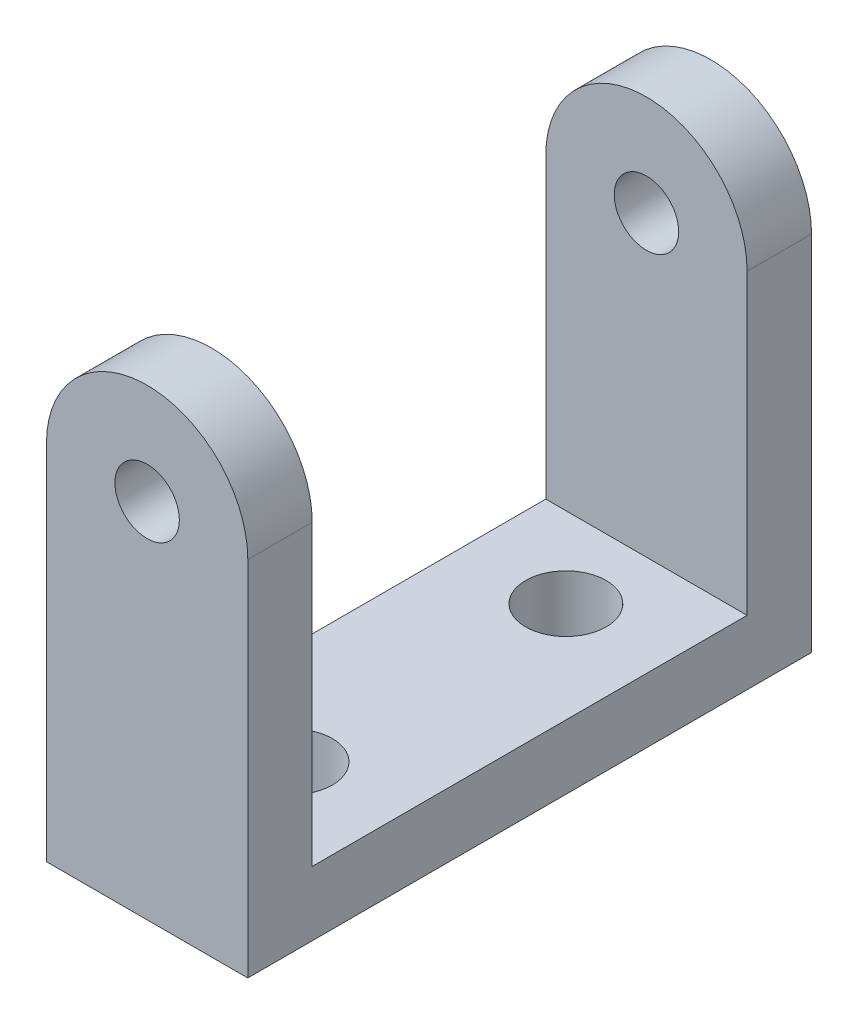
from build123d import *

# Parameters (mm, degrees)
SCHIZZO1_R                    = 4
ESTRUSIONE_ESTRUSIONE1_DEPTH  = 70
TAGLIO_ESTRUSIONE1_DEPTH      = 92.446705791
TAGLIO_ESTRUSIONE1_DEPTH_BACK = 92.446705791
SCHIZZO2_W                    = 54
SCHIZZO2_H                    = 49.5
SCHIZZO4_R                    = 5
TAGLIO_ESTRUSIONE2_DEPTH      = 92.446705791


with BuildPart() as part:
    # Schizzo1 → Estrusione-Estrusione1 (new body)
    with BuildSketch(Plane.XY):
        with BuildLine():
            Line((-12.5, 0), (12.5, 0))
            Line((12.5, 0), (12.5, 45))
            ThreePointArc((12.5, 45), (0, 57.5), (-12.5, 45))
            Line((-12.5, 45), (-12.5, 0))
        make_face()
        with Locations((0, 45)):
            Circle(SCHIZZO1_R, mode=Mode.SUBTRACT)
    extrude(amount=ESTRUSIONE_ESTRUSIONE1_DEPTH)

    # Schizzo2 → Taglio-Estrusione1 (cut, two sides: drawn at the far end of the back side and taken through both)
    with BuildSketch(Plane(origin=(0, 0, 0), x_dir=(0, 0, -1), z_dir=(1, 0, 0)).offset(-TAGLIO_ESTRUSIONE1_DEPTH_BACK)):
        with Locations((-35, 32.75)):
            Rectangle(SCHIZZO2_W, SCHIZZO2_H)
    extrude(amount=TAGLIO_ESTRUSIONE1_DEPTH + TAGLIO_ESTRUSIONE1_DEPTH_BACK, mode=Mode.SUBTRACT)

    # Schizzo4 → Taglio-Estrusione2 (cut, through all)
    with BuildSketch(Plane.XZ):
        with Locations((0, 18)):
            Circle(SCHIZZO4_R)
        with Locations((0, 52)):
            Circle(SCHIZZO4_R)
    extrude(amount=-TAGLIO_ESTRUSIONE2_DEPTH, mode=Mode.SUBTRACT)


solid = part.part
